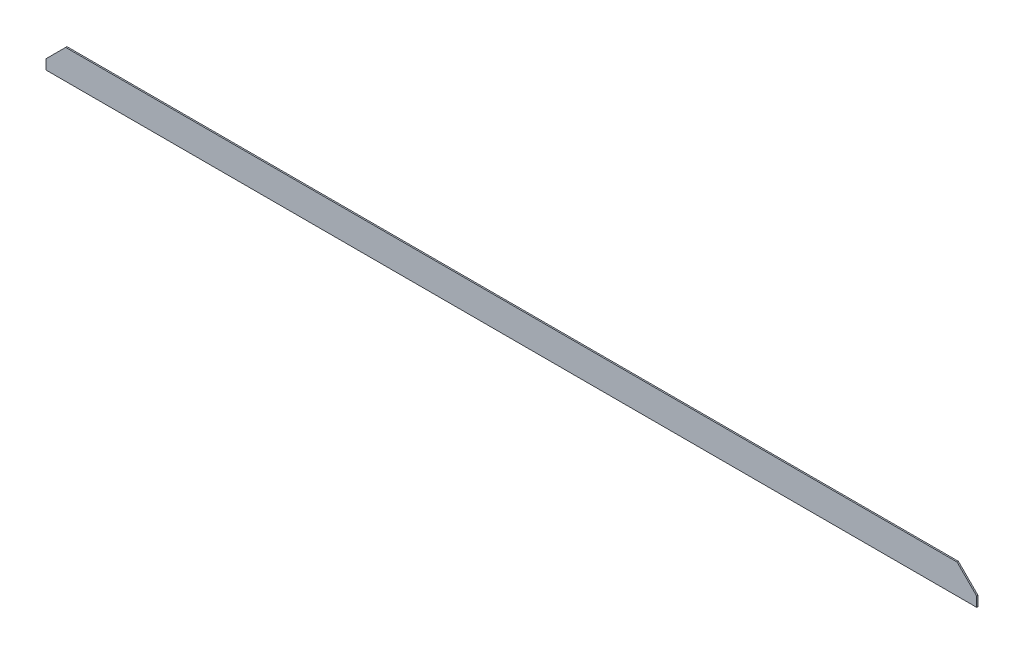
from build123d import *

# Parameters (mm, degrees)
SKETCH1_W           = 1421
SKETCH1_H           = 45
BOSS_EXTRUDE1_DEPTH = 2
CHAMFER1_SIZE       = 30


with BuildPart() as part:
    # Sketch1 → Boss-Extrude1 (new body)
    with BuildSketch(Plane.XY):
        Rectangle(SKETCH1_W, SKETCH1_H)
    extrude(amount=BOSS_EXTRUDE1_DEPTH)

    # Chamfer1
    chamfer1_edges = [part.edges().sort_by_distance(p)[0] for p in [
        (-710.5, 22.5, 1),
        (710.5, 22.5, 1),
    ]]
    chamfer(chamfer1_edges, length=CHAMFER1_SIZE)


solid = part.part
